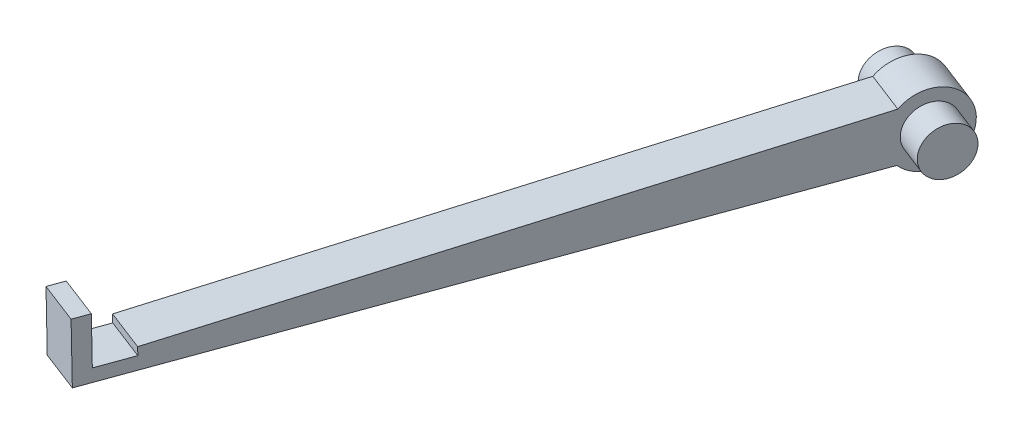
from build123d import *

# Parameters (mm, degrees)
BASE_DEPTH        = 1.4
BASE_DEPTH_BACK   = 1.4
BOSS_BLOC_G_DEPTH = 1.9
BOSS_START        = 1.9
BOSS_BLOC_D_DEPTH = 1.9


with BuildPart() as part:
    # Esquisse1 → BASE (new, two sides: drawn at the far end of the back side and taken through both)
    with BuildSketch(Plane(origin=(-65.300145961, -64.810459708, 252.692395796), x_dir=(-0.005843789485583505, 0.9998687257320568, 0.015112293915923657), z_dir=(0.9326954207343167, 1.4198852059309815e-15, 0.3606650137471557)).offset(-BASE_DEPTH_BACK)):
        with BuildLine():
            ThreePointArc((-13.905835762, -115.811989231), (-12.476603332, -119.757071622), (-10.803035184, -115.909273542))
            Line((-10.803035184, -115.909273542), (-12.597966981, -78.341921007))
            Line((-12.597966981, -78.341921007), (-13.097966981, -78.341921007))
            Line((-13.097966981, -78.341921007), (-13.097966981, -76.095588858))
            Line((-13.097966981, -76.095588858), (-10.086767597, -76.095588858))
            Line((-10.086767597, -76.095588858), (-10.086767597, -75.095588858))
            Line((-10.086767597, -75.095588858), (-13.905835762, -75.095588858))
            Line((-13.905835762, -75.095588858), (-13.905835762, -115.811989231))
        make_face()
    extrude(amount=BASE_DEPTH + BASE_DEPTH_BACK)

    # Esquisse2 → BOSS BLOC G (add)
    with BuildSketch(Plane(origin=(29.50317012, 0, 11.408613166), x_dir=(0.36066501374715604, 0, -0.9326954207343167), z_dir=(0.9326954207343167, 0, 0.36066501374715604))):
        with BuildLine():
            ThreePointArc((-142.624687975, -74.263433448), (-143.050736773, -75.335140044), (-142.590186903, -76.392479357))
            ThreePointArc((-142.590186903, -76.392479357), (-140.963090095, -76.690850279), (-140.050933684, -75.310835817))
            ThreePointArc((-140.050933684, -75.310835817), (-140.985527386, -73.921477793), (-142.624687975, -74.263433448))
        make_face()
    extrude(amount=BOSS_BLOC_G_DEPTH)

    # Esquisse3 → BOSS BLOC D (add)
    with BuildSketch(Plane(origin=(26.891622942, 0, 10.398751127), x_dir=(-0.36066501374715587, 0, 0.9326954207343167), z_dir=(-0.9326954207343167, 0, -0.36066501374715587)).offset(BOSS_START)):
        with BuildLine():
            ThreePointArc((143.050933684, -75.310835817), (142.940291708, -74.745429519), (142.624687975, -74.263433448))
            ThreePointArc((142.624687975, -74.263433448), (140.051130596, -75.28653159), (142.590186903, -76.392479357))
            ThreePointArc((142.590186903, -76.392479357), (142.930948146, -75.898679407), (143.050933684, -75.310835817))
        make_face()
    extrude(amount=-BOSS_BLOC_D_DEPTH)


solid = part.part
